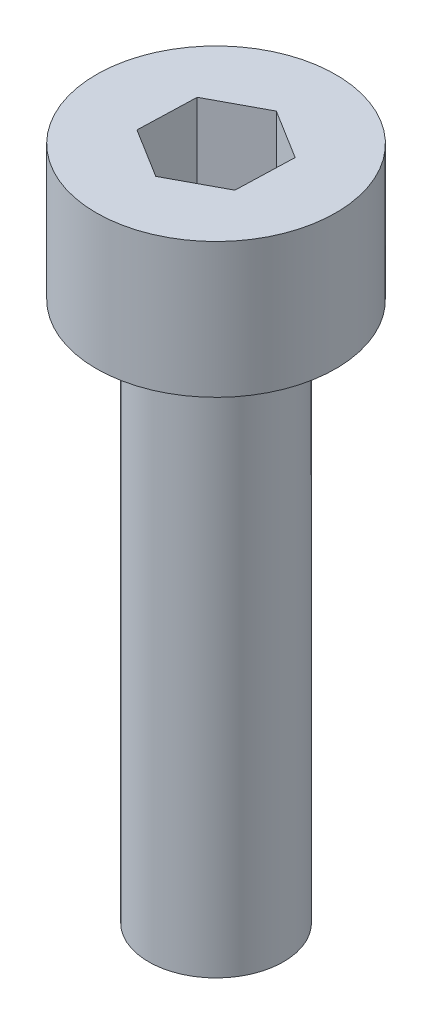
from build123d import *

# Parameters (mm, degrees)
SKETCH1_R           = 3.55
BOSS_EXTRUDE1_DEPTH = 4
SKETCH2_R           = 2
BOSS_EXTRUDE2_DEPTH = 16
CUT_EXTRUDE1_DEPTH  = 3


with BuildPart() as part:
    # Sketch1 → Boss-Extrude1 (new body)
    with BuildSketch(Plane(origin=(0, 0, 0), x_dir=(1, 0, 0), z_dir=(0, 1, 0))):
        with Locations(Location((0, 0, 0), (0, 0, 270))):
            Circle(SKETCH1_R)
    extrude(amount=BOSS_EXTRUDE1_DEPTH)

    # Sketch2 → Boss-Extrude2 (add)
    with BuildSketch(Plane.XZ):
        with Locations(Location((0, 0, 0), (0, 0, 270))):
            Circle(SKETCH2_R)
    extrude(amount=BOSS_EXTRUDE2_DEPTH)

    # Sketch3 → Cut-Extrude1 (cut)
    with BuildSketch(Plane(origin=(0, 4, 0), x_dir=(1, 0, 0), z_dir=(0, 1, 0))):
        Polygon((0.055152398, 1.731172497), (-1.471663161, 0.913349626), (-1.526815559, -0.81782287), (-0.055152398, -1.731172497), (1.471663161, -0.913349626), (1.526815559, 0.81782287), align=None)
    extrude(amount=-CUT_EXTRUDE1_DEPTH, mode=Mode.SUBTRACT)


solid = part.part
